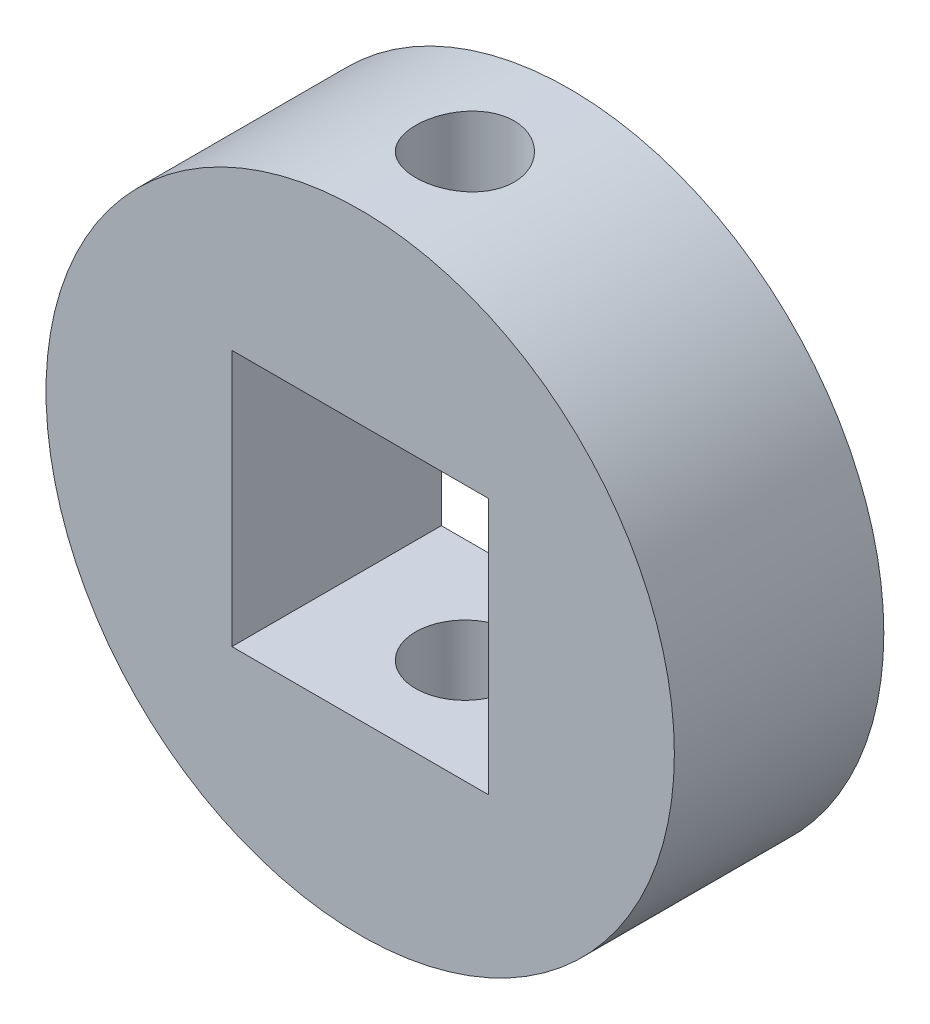
from build123d import *

# Parameters (mm, degrees)
ESBO_O1_R                  = 15
ESBO_O1_W                  = 12.25
ESBO_O1_H                  = 12.25
RESSALTO_EXTRUS_O1_DEPTH   = 10
CORTE_EXTRUS_O1_DEPTH      = 24
CORTE_EXTRUS_O1_DEPTH_BACK = 24
ESBO_O2_R                  = 2.35


with BuildPart() as part:
    # Esboço1 → Ressalto-extrusão1 (new body)
    with BuildSketch(Plane.XY):
        Circle(ESBO_O1_R)
        Rectangle(ESBO_O1_W, ESBO_O1_H, mode=Mode.SUBTRACT)
    extrude(amount=RESSALTO_EXTRUS_O1_DEPTH)

    # Esboço2 → Corte-extrusão1 (cut, two sides: drawn at the far end of the back side and taken through both)
    with BuildSketch(Plane(origin=(0, 0, 0), x_dir=(1, 0, 0), z_dir=(0, 1, 0)).offset(-CORTE_EXTRUS_O1_DEPTH_BACK)):
        with Locations(Location((0, -5, 0), (0, 0, 90))):
            Circle(ESBO_O2_R)
    extrude(amount=CORTE_EXTRUS_O1_DEPTH + CORTE_EXTRUS_O1_DEPTH_BACK, mode=Mode.SUBTRACT)


solid = part.part
